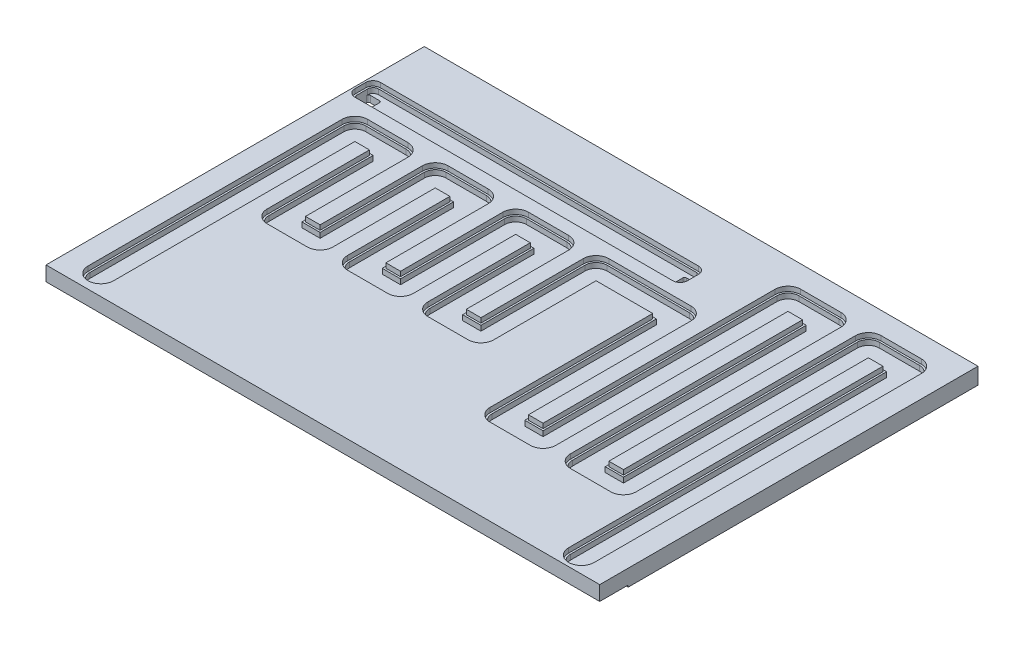
from build123d import *

# Parameters (mm, degrees)
SKETCH_1_W           = 1515
SKETCH_1_H           = 1035
EXTRUDE_1_DEPTH      = 45
CUT_EXTRUDE_1_DEPTH  = 13
CUT_EXTRUDE_2_DEPTH  = 27
CUT_EXTRUDE_3_DEPTH  = 45
CUT_EXTRUDE_5_DEPTH  = 13
CUT_EXTRUDE_6_DEPTH  = 27
SKETCH_3_R           = 10.25
CUT_EXTRUDE_7_DEPTH  = 45
CUT_EXTRUDE_8_DEPTH  = 5
SKETCH_6_R           = 5.25
SKETCH_6_R_2         = 8.75
CUT_EXTRUDE_9_DEPTH  = 25
SKETCH_6_4_R         = 8.75
CUT_EXTRUDE_10_DEPTH = 35


with BuildPart() as part:
    # 草图1 → 凸台-拉伸1 (new body)
    with BuildSketch(Plane(origin=(0, 0, 0), x_dir=(1, 0, 0), z_dir=(0, 1, 0))):
        with Locations((757.5, -517.5)):
            Rectangle(SKETCH_1_W, SKETCH_1_H)
    extrude(amount=-EXTRUDE_1_DEPTH)

    # 草图1<3> → 切除-拉伸1 (cut)
    with BuildSketch(Plane(origin=(0, 0, 0), x_dir=(1, 0, 0), z_dir=(0, 1, 0))):
        with BuildLine():
            Line((5, -195), (5, -165))
            ThreePointArc((5, -165), (10.857864376, -150.857864376), (25, -145))
            Line((25, -145), (895, -145))
            ThreePointArc((895, -145), (909.142135624, -150.857864376), (915, -165))
            Line((915, -165), (915, -195))
            ThreePointArc((915, -195), (909.142135624, -209.142135624), (895, -215))
            Line((895, -215), (25, -215))
            ThreePointArc((25, -215), (10.857864376, -209.142135624), (5, -195))
        make_face()
    extrude(amount=-CUT_EXTRUDE_1_DEPTH, mode=Mode.SUBTRACT)

    # 草图1<5> → 切除-拉伸2 (cut)
    with BuildSketch(Plane(origin=(0, 0, 0), x_dir=(1, 0, 0), z_dir=(0, 1, 0))):
        with BuildLine():
            Line((25, -150), (895, -150))
            ThreePointArc((895, -150), (905.606601718, -154.393398282), (910, -165))
            Line((910, -165), (910, -195))
            ThreePointArc((910, -195), (905.606601718, -205.606601718), (895, -210))
            Line((895, -210), (25, -210))
            ThreePointArc((25, -210), (14.393398282, -205.606601718), (10, -195))
            Line((10, -195), (10, -165))
            ThreePointArc((10, -165), (14.393398282, -154.393398282), (25, -150))
        make_face()
    extrude(amount=-CUT_EXTRUDE_2_DEPTH, mode=Mode.SUBTRACT)

    # 草图1<6> → 切除-拉伸3 (cut)
    with BuildSketch(Plane(origin=(0, 0, 0), x_dir=(1, 0, 0), z_dir=(0, 1, 0))):
        with BuildLine():
            Line((40, -197.5), (15, -197.5))
            ThreePointArc((15, -197.5), (11.464466094, -196.035533906), (10, -192.5))
            Line((10, -192.5), (10, -167.5))
            ThreePointArc((10, -167.5), (11.464466094, -163.964466094), (15, -162.5))
            Line((15, -162.5), (40, -162.5))
            ThreePointArc((40, -162.5), (43.535533906, -163.964466094), (45, -167.5))
            Line((45, -167.5), (45, -192.5))
            ThreePointArc((45, -192.5), (43.535533906, -196.035533906), (40, -197.5))
        make_face()
        with BuildLine():
            Line((905, -197.5), (880, -197.5))
            ThreePointArc((880, -197.5), (876.464466094, -196.035533906), (875, -192.5))
            Line((875, -192.5), (875, -167.5))
            ThreePointArc((875, -167.5), (876.464466094, -163.964466094), (880, -162.5))
            Line((880, -162.5), (905, -162.5))
            ThreePointArc((905, -162.5), (908.535533906, -163.964466094), (910, -167.5))
            Line((910, -167.5), (910, -192.5))
            ThreePointArc((910, -192.5), (908.535533906, -196.035533906), (905, -197.5))
        make_face()
    extrude(amount=-CUT_EXTRUDE_3_DEPTH, mode=Mode.SUBTRACT)

    # 草图1<9> → 切除-拉伸5 (cut)
    with BuildSketch(Plane(origin=(0, 0, 0), x_dir=(1, 0, 0), z_dir=(0, 1, 0))):
        with BuildLine():
            Line((60, -980), (60, -285))
            ThreePointArc((60, -285), (70.251262658, -260.251262658), (95, -250))
            Line((95, -250), (205, -250))
            ThreePointArc((205, -250), (229.748737342, -260.251262658), (240, -285))
            Line((240, -285), (240, -565))
            Line((240, -565), (280, -565))
            Line((280, -565), (280, -285))
            ThreePointArc((280, -285), (290.251262658, -260.251262658), (315, -250))
            Line((315, -250), (425, -250))
            ThreePointArc((425, -250), (449.748737342, -260.251262658), (460, -285))
            Line((460, -285), (460, -565))
            Line((460, -565), (500, -565))
            Line((500, -565), (500, -285))
            ThreePointArc((500, -285), (510.251262658, -260.251262658), (535, -250))
            Line((535, -250), (645, -250))
            ThreePointArc((645, -250), (669.748737342, -260.251262658), (680, -285))
            Line((680, -285), (680, -565))
            Line((680, -565), (720, -565))
            Line((720, -565), (720, -285))
            ThreePointArc((720, -285), (730.251262658, -260.251262658), (755, -250))
            Line((755, -250), (980, -250))
            ThreePointArc((980, -250), (1004.748737342, -260.251262658), (1015, -285))
            Line((1015, -285), (1015, -730))
            Line((1015, -730), (1055, -730))
            Line((1055, -730), (1055, -95))
            ThreePointArc((1055, -95), (1065.251262658, -70.251262658), (1090, -60))
            Line((1090, -60), (1200, -60))
            ThreePointArc((1200, -60), (1224.748737342, -70.251262658), (1235, -95))
            Line((1235, -95), (1235, -730))
            Line((1235, -730), (1275, -730))
            Line((1275, -730), (1275, -95))
            ThreePointArc((1275, -95), (1285.251262658, -70.251262658), (1310, -60))
            Line((1310, -60), (1420, -60))
            ThreePointArc((1420, -60), (1444.748737342, -70.251262658), (1455, -95))
            Line((1455, -95), (1455, -990))
            ThreePointArc((1455, -990), (1420, -1025), (1385, -990))
            Line((1385, -990), (1385, -130))
            Line((1385, -130), (1345, -130))
            Line((1345, -130), (1345, -765))
            ThreePointArc((1345, -765), (1334.748737342, -789.748737342), (1310, -800))
            Line((1310, -800), (1200, -800))
            ThreePointArc((1200, -800), (1175.251262658, -789.748737342), (1165, -765))
            Line((1165, -765), (1165, -130))
            Line((1165, -130), (1125, -130))
            Line((1125, -130), (1125, -765))
            ThreePointArc((1125, -765), (1114.748737342, -789.748737342), (1090, -800))
            Line((1090, -800), (980, -800))
            ThreePointArc((980, -800), (955.251262658, -789.748737342), (945, -765))
            Line((945, -765), (945, -320))
            Line((945, -320), (790, -320))
            Line((790, -320), (790, -600))
            ThreePointArc((790, -600), (779.748737342, -624.748737342), (755, -635))
            Line((755, -635), (645, -635))
            ThreePointArc((645, -635), (620.251262658, -624.748737342), (610, -600))
            Line((610, -600), (610, -320))
            Line((610, -320), (570, -320))
            Line((570, -320), (570, -600))
            ThreePointArc((570, -600), (559.748737342, -624.748737342), (535, -635))
            Line((535, -635), (425, -635))
            ThreePointArc((425, -635), (400.251262658, -624.748737342), (390, -600))
            Line((390, -600), (390, -320))
            Line((390, -320), (350, -320))
            Line((350, -320), (350, -600))
            ThreePointArc((350, -600), (339.748737342, -624.748737342), (315, -635))
            Line((315, -635), (205, -635))
            ThreePointArc((205, -635), (180.251262658, -624.748737342), (170, -600))
            Line((170, -600), (170, -320))
            Line((170, -320), (130, -320))
            Line((130, -320), (130, -980))
            ThreePointArc((130, -980), (95, -1015), (60, -980))
        make_face()
    extrude(amount=-CUT_EXTRUDE_5_DEPTH, mode=Mode.SUBTRACT)

    # 草图1<10> → 切除-拉伸6 (cut)
    with BuildSketch(Plane(origin=(0, 0, 0), x_dir=(1, 0, 0), z_dir=(0, 1, 0))):
        with BuildLine():
            Line((1390, -990), (1390, -125))
            Line((1390, -125), (1340, -125))
            Line((1340, -125), (1340, -765))
            ThreePointArc((1340, -765), (1331.213203436, -786.213203436), (1310, -795))
            Line((1310, -795), (1200, -795))
            ThreePointArc((1200, -795), (1178.786796564, -786.213203436), (1170, -765))
            Line((1170, -765), (1170, -125))
            Line((1170, -125), (1120, -125))
            Line((1120, -125), (1120, -765))
            ThreePointArc((1120, -765), (1111.213203436, -786.213203436), (1090, -795))
            Line((1090, -795), (980, -795))
            ThreePointArc((980, -795), (958.786796564, -786.213203436), (950, -765))
            Line((950, -765), (950, -315))
            Line((950, -315), (785, -315))
            Line((785, -315), (785, -600))
            ThreePointArc((785, -600), (776.213203436, -621.213203436), (755, -630))
            Line((755, -630), (645, -630))
            ThreePointArc((645, -630), (623.786796564, -621.213203436), (615, -600))
            Line((615, -600), (615, -315))
            Line((615, -315), (565, -315))
            Line((565, -315), (565, -600))
            ThreePointArc((565, -600), (556.213203436, -621.213203436), (535, -630))
            Line((535, -630), (425, -630))
            ThreePointArc((425, -630), (403.786796564, -621.213203436), (395, -600))
            Line((395, -600), (395, -315))
            Line((395, -315), (345, -315))
            Line((345, -315), (345, -600))
            ThreePointArc((345, -600), (336.213203436, -621.213203436), (315, -630))
            Line((315, -630), (205, -630))
            ThreePointArc((205, -630), (183.786796564, -621.213203436), (175, -600))
            Line((175, -600), (175, -315))
            Line((175, -315), (125, -315))
            Line((125, -315), (125, -980))
            ThreePointArc((125, -980), (95, -1010), (65, -980))
            Line((65, -980), (65, -285))
            ThreePointArc((65, -285), (73.786796564, -263.786796564), (95, -255))
            Line((95, -255), (205, -255))
            ThreePointArc((205, -255), (226.213203436, -263.786796564), (235, -285))
            Line((235, -285), (235, -570))
            Line((235, -570), (285, -570))
            Line((285, -570), (285, -285))
            ThreePointArc((285, -285), (293.786796564, -263.786796564), (315, -255))
            Line((315, -255), (425, -255))
            ThreePointArc((425, -255), (446.213203436, -263.786796564), (455, -285))
            Line((455, -285), (455, -570))
            Line((455, -570), (505, -570))
            Line((505, -570), (505, -285))
            ThreePointArc((505, -285), (513.786796564, -263.786796564), (535, -255))
            Line((535, -255), (645, -255))
            ThreePointArc((645, -255), (666.213203436, -263.786796564), (675, -285))
            Line((675, -285), (675, -570))
            Line((675, -570), (725, -570))
            Line((725, -570), (725, -285))
            ThreePointArc((725, -285), (733.786796564, -263.786796564), (755, -255))
            Line((755, -255), (980, -255))
            ThreePointArc((980, -255), (1001.213203436, -263.786796564), (1010, -285))
            Line((1010, -285), (1010, -735))
            Line((1010, -735), (1060, -735))
            Line((1060, -735), (1060, -95))
            ThreePointArc((1060, -95), (1068.786796564, -73.786796564), (1090, -65))
            Line((1090, -65), (1200, -65))
            ThreePointArc((1200, -65), (1221.213203436, -73.786796564), (1230, -95))
            Line((1230, -95), (1230, -735))
            Line((1230, -735), (1280, -735))
            Line((1280, -735), (1280, -95))
            ThreePointArc((1280, -95), (1288.786796564, -73.786796564), (1310, -65))
            Line((1310, -65), (1420, -65))
            ThreePointArc((1420, -65), (1441.213203436, -73.786796564), (1450, -95))
            Line((1450, -95), (1450, -990))
            ThreePointArc((1450, -990), (1420, -1020), (1390, -990))
        make_face()
    extrude(amount=-CUT_EXTRUDE_6_DEPTH, mode=Mode.SUBTRACT)

    # 草图3 → 切除-拉伸7 (cut)
    with BuildSketch(Plane(origin=(0, 0, 0), x_dir=(1, 0, 0), z_dir=(0, 1, 0))):
        with Locations((95, -990)):
            Circle(SKETCH_3_R)
        with Locations((1420, -1007.5)):
            Circle(SKETCH_3_R)
    extrude(amount=-CUT_EXTRUDE_7_DEPTH, mode=Mode.SUBTRACT)

    # 草图5 → 切除-拉伸8 (cut)
    with BuildSketch(Plane.XZ.offset(45)):
        Polygon((0, 932), (0, 1035), (1515, 1035), (1515, 957), (885, 957), (865, 937), (865, 932), align=None)
    extrude(amount=-CUT_EXTRUDE_8_DEPTH, mode=Mode.SUBTRACT)

    # 草图6 → 切除-拉伸9 (cut)
    with BuildSketch(Plane.XZ.offset(45)):
        with Locations((710, 875)):
            Circle(SKETCH_6_R)
        with Locations((605, 875)):
            Circle(SKETCH_6_R)
        with Locations((500, 875)):
            Circle(SKETCH_6_R)
        with Locations((395, 875)):
            Circle(SKETCH_6_R)
        with Locations((290, 875)):
            Circle(SKETCH_6_R)
        with Locations((185, 875)):
            Circle(SKETCH_6_R)
        with Locations((150, 673)):
            Circle(SKETCH_6_R)
        with Locations((246, 673)):
            Circle(SKETCH_6_R)
        with Locations((659, 673)):
            Circle(SKETCH_6_R)
        with Locations((755, 673)):
            Circle(SKETCH_6_R)
        with Locations((325, 40)):
            Circle(SKETCH_6_R)
        with Locations((385, 40)):
            Circle(SKETCH_6_R)
        with Locations((520, 40)):
            Circle(SKETCH_6_R)
        with Locations((580, 40)):
            Circle(SKETCH_6_R)
        with Locations((1045, 35)):
            Circle(SKETCH_6_R_2)
        with Locations((1395, 35)):
            Circle(SKETCH_6_R_2)
    extrude(amount=-CUT_EXTRUDE_9_DEPTH, mode=Mode.SUBTRACT)

    # 草图6<4> → 切除-拉伸10 (cut)
    with BuildSketch(Plane.XZ.offset(45)):
        with Locations((1045, 35)):
            Circle(SKETCH_6_4_R)
        with Locations((1395, 35)):
            Circle(SKETCH_6_4_R)
    extrude(amount=-CUT_EXTRUDE_10_DEPTH, mode=Mode.SUBTRACT)


solid = part.part
